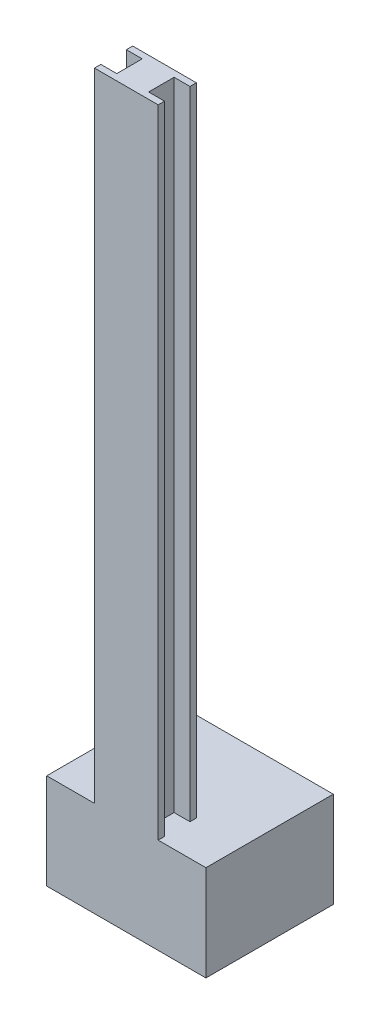
from build123d import *

# Parameters (mm, degrees)
ESQUISSE1_W        = 50
ESQUISSE1_H        = 40
BOSS_EXTRU_1_DEPTH = 30
BOSS_EXTRU_2_DEPTH = 200


with BuildPart() as part:
    # Esquisse1 → Boss.-Extru.1 (new body)
    with BuildSketch(Plane(origin=(0, 0, 0), x_dir=(1, 0, 0), z_dir=(0, 1, 0))):
        Rectangle(ESQUISSE1_W, ESQUISSE1_H)
    extrude(amount=BOSS_EXTRU_1_DEPTH)

    # Esquisse2 → Boss.-Extru.2 (add)
    with BuildSketch(Plane(origin=(0, 30, 0), x_dir=(1, 0, 0), z_dir=(0, 1, 0))):
        Polygon((-10, -20), (10, -20), (10, -18), (5, -18), (5, -10), (10, -10), (10, -8), (-10, -8), (-10, -10), (-5, -10), (-5, -18), (-10, -18), align=None)
    extrude(amount=BOSS_EXTRU_2_DEPTH)


solid = part.part
